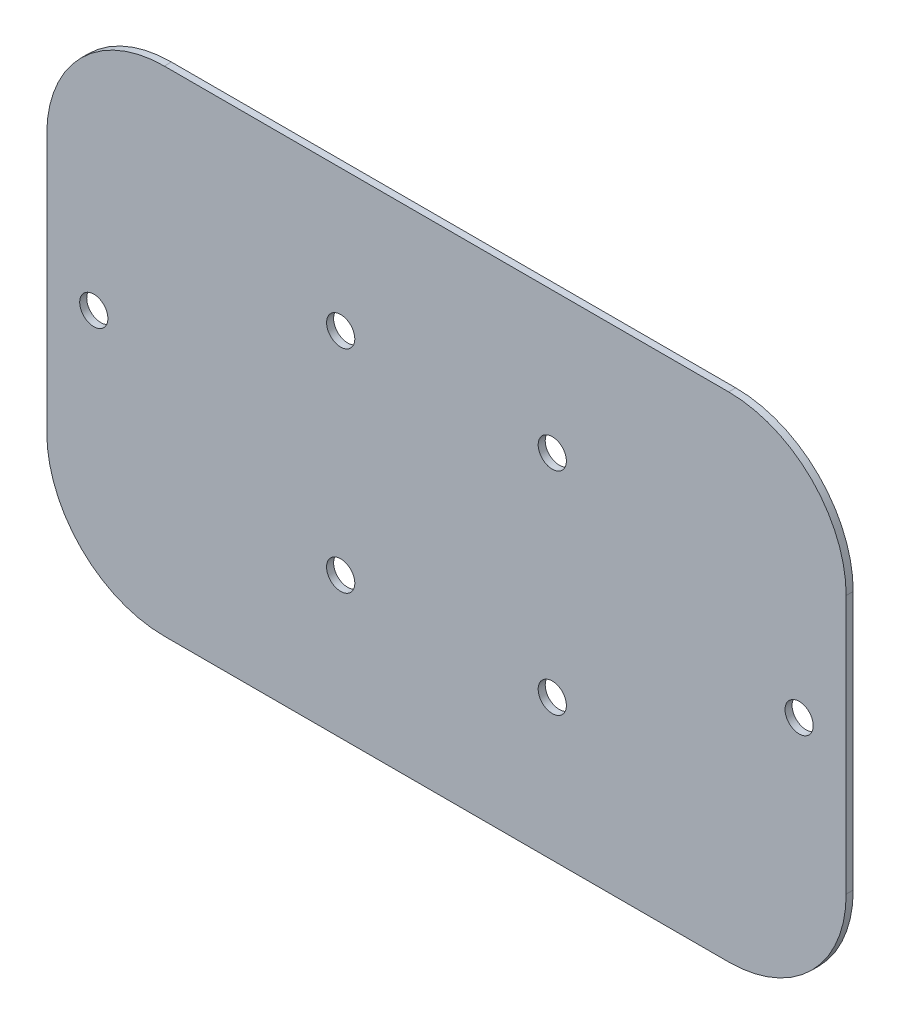
from build123d import *

# Parameters (mm, degrees)
DODANIE_WYCI_GNI_CIE1_DEPTH = 3
OTWORY_USTALAJ_CE_12_0MM1_D = 12


with BuildPart() as part:
    # Szkic1 → Dodanie-wyciągnięcie1 (new body)
    with BuildSketch(Plane.XY):
        with BuildLine():
            Line((-120, -105), (120, -105))
            ThreePointArc((120, -105), (155.355339059, -90.355339059), (170, -55))
            Line((170, -55), (170, 55))
            ThreePointArc((170, 55), (155.355339059, 90.355339059), (120, 105))
            Line((120, 105), (-120, 105))
            ThreePointArc((-120, 105), (-155.355339059, 90.355339059), (-170, 55))
            Line((-170, 55), (-170, -55))
            ThreePointArc((-170, -55), (-155.355339059, -90.355339059), (-120, -105))
        make_face()
    extrude(amount=DODANIE_WYCI_GNI_CIE1_DEPTH)

    # Otwory ustalające Ø12.0mm1 (through all)
    with Locations(Plane(origin=(0, 0, 0), x_dir=(-1, 0, 0), z_dir=(0, 0, -1))):
        with Locations((45, 45), (-45, 45), (45, -45), (-45, -45), (-150, 0), (150, 0)):
            Hole(OTWORY_USTALAJ_CE_12_0MM1_D / 2)


solid = part.part
